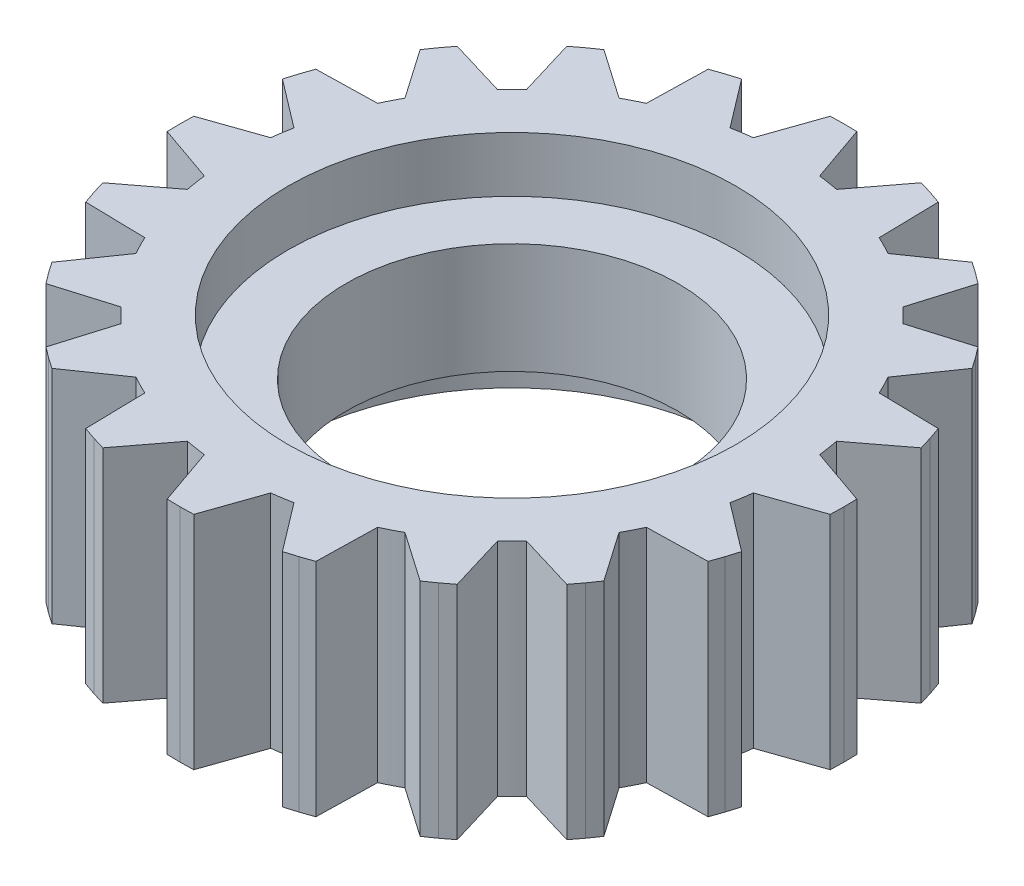
from build123d import *

# Parameters (mm, degrees)
SKETCH1_R           = 20.25
BOSS_EXTRUDE1_DEPTH = 10
SKETCH1_3_R         = 20.25
SKETCH1_3_R_2       = 15
BOSS_EXTRUDE2_DEPTH = 5


with BuildPart() as part:
    # Sketch1 → Boss-Extrude1 (new, symmetric)
    with BuildSketch(Plane(origin=(0, 0, 0), x_dir=(1, 0, 0), z_dir=(0, 1, 0))):
        with BuildLine():
            Line((29.976, -1.199759976), (30, 0))
            Line((30, 0), (29.976, 1.199759976))
            Line((29.976, 1.199759976), (24.819347292, 3))
            ThreePointArc((24.819347292, 3), (24.692208515, 3.910861626), (24.531652955, 4.816430554))
            Line((24.531652955, 4.816430554), (28.879616354, 8.12205388))
            Line((28.879616354, 8.12205388), (28.531695489, 9.270509831))
            Line((28.531695489, 9.270509831), (28.138123911, 10.404132967))
            Line((28.138123911, 10.404132967), (22.677550989, 10.522769651))
            ThreePointArc((22.677550989, 10.522769651), (22.275163105, 11.349762493), (21.842629505, 12.161395327))
            Line((21.842629505, 12.161395327), (24.956294644, 16.648824513))
            Line((24.956294644, 16.648824513), (24.270509831, 17.633557569))
            Line((24.270509831, 17.633557569), (23.545892203, 18.590076932))
            Line((23.545892203, 18.590076932), (18.315917992, 17.015497293))
            ThreePointArc((18.315917992, 17.015497293), (17.67766953, 17.67766953), (17.015497293, 18.315917992))
            Line((17.015497293, 18.315917992), (18.590076932, 23.545892203))
            Line((18.590076932, 23.545892203), (17.633557569, 24.270509831))
            Line((17.633557569, 24.270509831), (16.648824513, 24.956294644))
            Line((16.648824513, 24.956294644), (12.161395327, 21.842629505))
            ThreePointArc((12.161395327, 21.842629505), (11.349762493, 22.275163105), (10.522769651, 22.677550989))
            Line((10.522769651, 22.677550989), (10.404132967, 28.138123911))
            Line((10.404132967, 28.138123911), (9.270509831, 28.531695489))
            Line((9.270509831, 28.531695489), (8.12205388, 28.879616354))
            Line((8.12205388, 28.879616354), (4.816430554, 24.531652955))
            ThreePointArc((4.816430554, 24.531652955), (3.910861626, 24.692208515), (3, 24.819347292))
            Line((3, 24.819347292), (1.199759976, 29.976))
            Line((1.199759976, 29.976), (0, 30))
            Line((0, 30), (-1.199759976, 29.976))
            Line((-1.199759976, 29.976), (-3, 24.819347292))
            ThreePointArc((-3, 24.819347292), (-3.910861626, 24.692208515), (-4.816430554, 24.531652955))
            Line((-4.816430554, 24.531652955), (-8.12205388, 28.879616354))
            Line((-8.12205388, 28.879616354), (-9.270509831, 28.531695489))
            Line((-9.270509831, 28.531695489), (-10.404132967, 28.138123911))
            Line((-10.404132967, 28.138123911), (-10.522769651, 22.677550989))
            ThreePointArc((-10.522769651, 22.677550989), (-11.349762493, 22.275163105), (-12.161395327, 21.842629505))
            Line((-12.161395327, 21.842629505), (-16.648824513, 24.956294644))
            Line((-16.648824513, 24.956294644), (-17.633557569, 24.270509831))
            Line((-17.633557569, 24.270509831), (-18.590076932, 23.545892203))
            Line((-18.590076932, 23.545892203), (-17.015497293, 18.315917992))
            ThreePointArc((-17.015497293, 18.315917992), (-17.67766953, 17.67766953), (-18.315917992, 17.015497293))
            Line((-18.315917992, 17.015497293), (-23.545892203, 18.590076932))
            Line((-23.545892203, 18.590076932), (-24.270509831, 17.633557569))
            Line((-24.270509831, 17.633557569), (-24.956294644, 16.648824513))
            Line((-24.956294644, 16.648824513), (-21.842629505, 12.161395327))
            ThreePointArc((-21.842629505, 12.161395327), (-22.275163105, 11.349762493), (-22.677550989, 10.522769651))
            Line((-22.677550989, 10.522769651), (-28.138123911, 10.404132967))
            Line((-28.138123911, 10.404132967), (-28.531695489, 9.270509831))
            Line((-28.531695489, 9.270509831), (-28.879616354, 8.12205388))
            Line((-28.879616354, 8.12205388), (-24.531652955, 4.816430554))
            ThreePointArc((-24.531652955, 4.816430554), (-24.692208515, 3.910861626), (-24.819347292, 3))
            Line((-24.819347292, 3), (-29.976, 1.199759976))
            Line((-29.976, 1.199759976), (-30, 0))
            Line((-30, 0), (-29.976, -1.199759976))
            Line((-29.976, -1.199759976), (-24.819347292, -3))
            ThreePointArc((-24.819347292, -3), (-24.692208515, -3.910861626), (-24.531652955, -4.816430554))
            Line((-24.531652955, -4.816430554), (-28.879616354, -8.12205388))
            Line((-28.879616354, -8.12205388), (-28.531695489, -9.270509831))
            Line((-28.531695489, -9.270509831), (-28.138123911, -10.404132967))
            Line((-28.138123911, -10.404132967), (-22.677550989, -10.522769651))
            ThreePointArc((-22.677550989, -10.522769651), (-22.275163105, -11.349762493), (-21.842629505, -12.161395327))
            Line((-21.842629505, -12.161395327), (-24.956294644, -16.648824513))
            Line((-24.956294644, -16.648824513), (-24.270509831, -17.633557569))
            Line((-24.270509831, -17.633557569), (-23.545892203, -18.590076932))
            Line((-23.545892203, -18.590076932), (-18.315917992, -17.015497293))
            ThreePointArc((-18.315917992, -17.015497293), (-17.67766953, -17.67766953), (-17.015497293, -18.315917992))
            Line((-17.015497293, -18.315917992), (-18.590076932, -23.545892203))
            Line((-18.590076932, -23.545892203), (-17.633557569, -24.270509831))
            Line((-17.633557569, -24.270509831), (-16.648824513, -24.956294644))
            Line((-16.648824513, -24.956294644), (-12.161395327, -21.842629505))
            ThreePointArc((-12.161395327, -21.842629505), (-11.349762493, -22.275163105), (-10.522769651, -22.677550989))
            Line((-10.522769651, -22.677550989), (-10.404132967, -28.138123911))
            Line((-10.404132967, -28.138123911), (-9.270509831, -28.531695489))
            Line((-9.270509831, -28.531695489), (-8.12205388, -28.879616354))
            Line((-8.12205388, -28.879616354), (-4.816430554, -24.531652955))
            ThreePointArc((-4.816430554, -24.531652955), (-3.910861626, -24.692208515), (-3, -24.819347292))
            Line((-3, -24.819347292), (-1.199759976, -29.976))
            Line((-1.199759976, -29.976), (0, -30))
            Line((0, -30), (1.199759976, -29.976))
            Line((1.199759976, -29.976), (3, -24.819347292))
            ThreePointArc((3, -24.819347292), (3.910861626, -24.692208515), (4.816430554, -24.531652955))
            Line((4.816430554, -24.531652955), (8.12205388, -28.879616354))
            Line((8.12205388, -28.879616354), (9.270509831, -28.531695489))
            Line((9.270509831, -28.531695489), (10.404132967, -28.138123911))
            Line((10.404132967, -28.138123911), (10.522769651, -22.677550989))
            ThreePointArc((10.522769651, -22.677550989), (11.349762493, -22.275163105), (12.161395327, -21.842629505))
            Line((12.161395327, -21.842629505), (16.648824513, -24.956294644))
            Line((16.648824513, -24.956294644), (17.633557569, -24.270509831))
            Line((17.633557569, -24.270509831), (18.590076932, -23.545892203))
            Line((18.590076932, -23.545892203), (17.015497293, -18.315917992))
            ThreePointArc((17.015497293, -18.315917992), (17.67766953, -17.67766953), (18.315917992, -17.015497293))
            Line((18.315917992, -17.015497293), (23.545892203, -18.590076932))
            Line((23.545892203, -18.590076932), (24.270509831, -17.633557569))
            Line((24.270509831, -17.633557569), (24.956294644, -16.648824513))
            Line((24.956294644, -16.648824513), (21.842629505, -12.161395327))
            ThreePointArc((21.842629505, -12.161395327), (22.275163105, -11.349762493), (22.677550989, -10.522769651))
            Line((22.677550989, -10.522769651), (28.138123911, -10.404132967))
            Line((28.138123911, -10.404132967), (28.531695489, -9.270509831))
            Line((28.531695489, -9.270509831), (28.879616354, -8.12205388))
            Line((28.879616354, -8.12205388), (24.531652955, -4.816430554))
            ThreePointArc((24.531652955, -4.816430554), (24.692208515, -3.910861626), (24.819347292, -3))
            Line((24.819347292, -3), (29.976, -1.199759976))
        make_face()
        Circle(SKETCH1_R, mode=Mode.SUBTRACT)
    extrude(amount=BOSS_EXTRUDE1_DEPTH, both=True)

    # Sketch1<3> → Boss-Extrude2 (add, symmetric)
    with BuildSketch(Plane(origin=(0, 0, 0), x_dir=(1, 0, 0), z_dir=(0, 1, 0))):
        Circle(SKETCH1_3_R)
        Circle(SKETCH1_3_R_2, mode=Mode.SUBTRACT)
    extrude(amount=BOSS_EXTRUDE2_DEPTH, both=True)


solid = part.part
